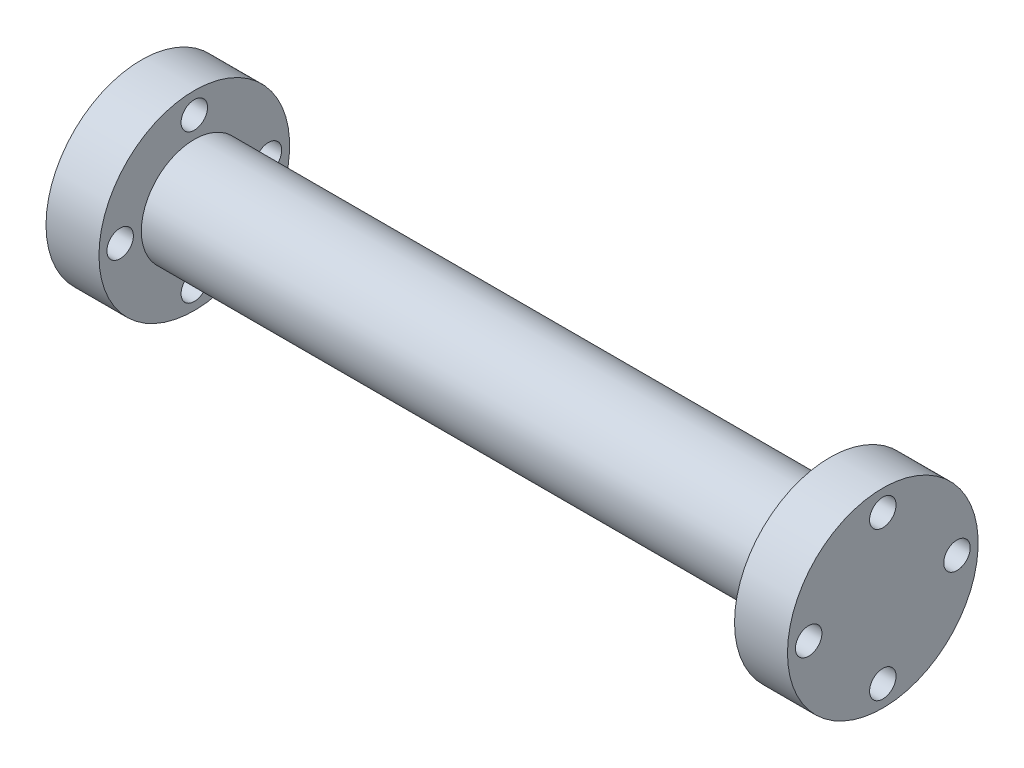
from build123d import *

# Parameters (mm, degrees)
HOLE_WIZARD_M3_1_D     = 2.5
HOLE_WIZARD_M3_1_DEPTH = 5
HOLE_WIZARD_M3_1_TIP   = 0.751075774
HOLE_WIZARD_M3_2_D     = 2.5
HOLE_WIZARD_M3_2_DEPTH = 5
HOLE_WIZARD_M3_2_TIP   = 0.751075774


with BuildPart() as part:
    # 草图1 → 旋转1 (revolve)
    with BuildSketch(Plane.XY, mode=Mode.PRIVATE) as revolve_1_sk:
        Polygon((-43.905067628, 0), (26.094932372, 0), (26.094932372, 9), (21.094932372, 9), (21.094932372, 5), (-38.905067628, 5), (-38.905067628, 9), (-43.905067628, 9), align=None)
    revolve(revolve_1_sk.sketch.rotate(Axis((-43.905067628, 0, 0), (1, 0, 0)), 90), axis=Axis((-43.905067628, 0, 0), (1, 0, 0)))

    # M3 螺纹孔1
    with Locations(Plane.ZY.offset(43.905067628)):
        with Locations((7, 0), (0, 7), (-7, 0), (0, -7)):
            Hole(HOLE_WIZARD_M3_1_D / 2, depth=HOLE_WIZARD_M3_1_DEPTH)
            with Locations((0, 0, -(HOLE_WIZARD_M3_1_DEPTH + HOLE_WIZARD_M3_1_TIP / 2))):  # 118° drill point
                Cone(0, HOLE_WIZARD_M3_1_D / 2, HOLE_WIZARD_M3_1_TIP, mode=Mode.SUBTRACT)

    # M3 螺纹孔2
    with Locations(Plane(origin=(26.094932372, 0, 0), x_dir=(0, 0, -1), z_dir=(1, 0, 0))):
        with Locations((0, -7), (7, 0), (0, 7), (-7, 0)):
            Hole(HOLE_WIZARD_M3_2_D / 2, depth=HOLE_WIZARD_M3_2_DEPTH)
            with Locations((0, 0, -(HOLE_WIZARD_M3_2_DEPTH + HOLE_WIZARD_M3_2_TIP / 2))):  # 118° drill point
                Cone(0, HOLE_WIZARD_M3_2_D / 2, HOLE_WIZARD_M3_2_TIP, mode=Mode.SUBTRACT)


solid = part.part
